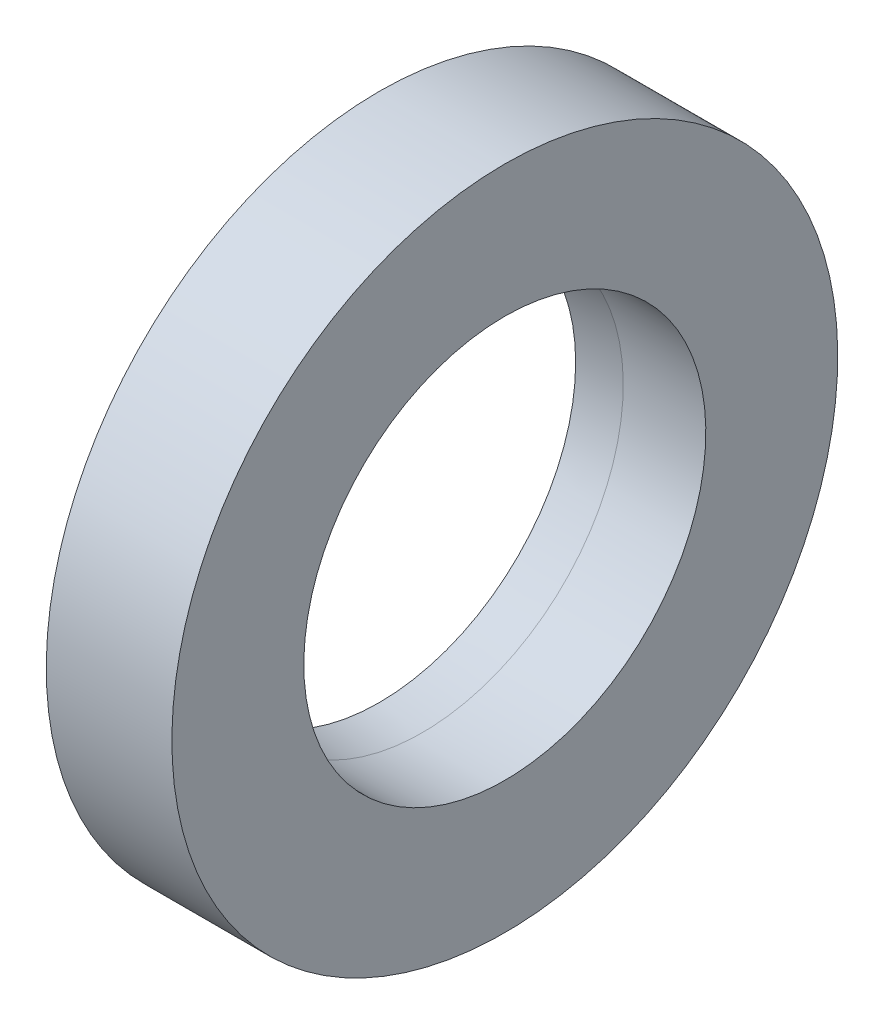
from build123d import *


with BuildPart() as part:
    # Croquis1 → Revolución1 (revolve)
    with BuildSketch(Plane.XY):
        with BuildLine():
            Line((17.736410427, 26.5), (27.736410427, 26.5))
            Line((27.736410427, 26.5), (27.736410427, 16))
            Line((27.736410427, 16), (21.163988978, 16))
            Line((21.163988978, 16), (17.736410427, 15.639375442))
            Line((17.736410427, 15.639375442), (17.736410427, 17.310836969))
            Line((17.736410427, 17.310836969), (21.981402985, 19.98631181))
            ThreePointArc((21.981402985, 19.98631181), (22.681602121, 21.252464086), (21.986190134, 22.521251927))
            Line((21.986190134, 22.521251927), (19.450199702, 24.133015759))
            Line((19.450199702, 24.133015759), (19.450199702, 24.770374886))
            Line((19.450199702, 24.770374886), (17.736410427, 24.770374886))
            Line((17.736410427, 24.770374886), (17.736410427, 26.5))
        make_face()
    revolve(axis=Axis((54.736410427, 0, 0), (-1, 0, 0)))


solid = part.part
